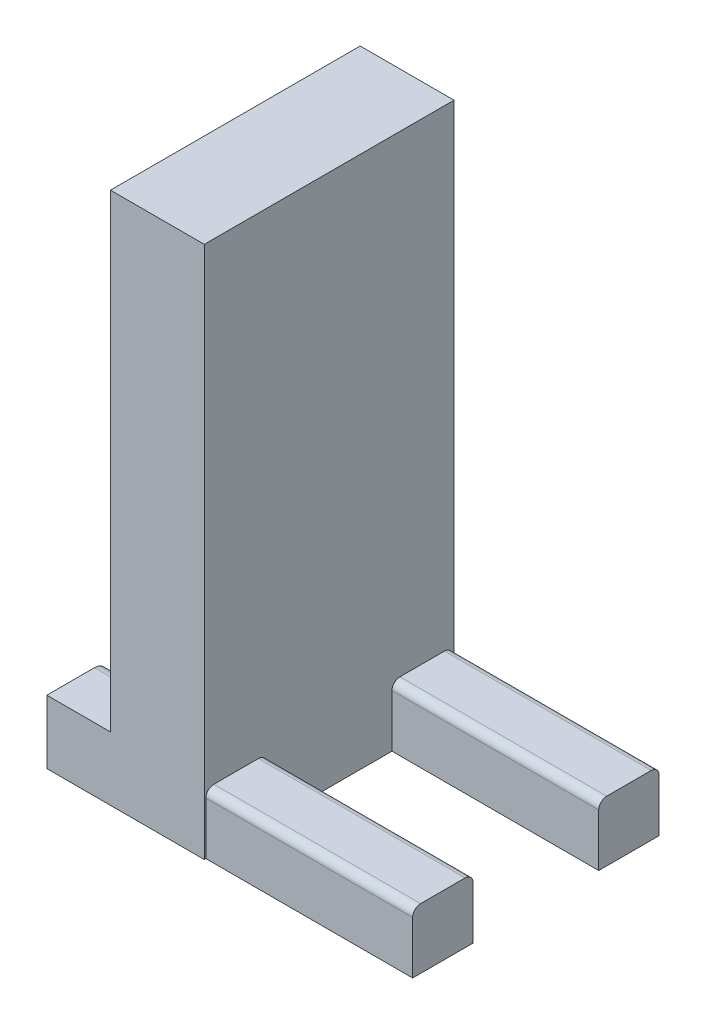
from build123d import *

# Parameters (mm, degrees)
SKETCH_2_W          = 5.9
SKETCH_2_H          = 15.7
EXTRUDE_1_DEPTH     = 33.5
SKETCH_3_R          = 0.975
CUT_EXTRUDE_1_DEPTH = 10
SKETCH_4_W          = 3.8
SKETCH_4_H          = 3.8
EXTRUDE_2_DEPTH     = 13
SKETCH_5_W          = 3.8
SKETCH_5_H          = 4
EXTRUDE_3_DEPTH     = 4
FILLET_1_R          = 0.8
FILLET_2_R          = 0.5


with BuildPart() as part:
    # ｽｹｯﾁ2 → ﾎﾞｽ - 押し出し1 (new body)
    with BuildSketch(Plane(origin=(0, 0, 0), x_dir=(1, 0, 0), z_dir=(0, 1, 0))):
        Rectangle(SKETCH_2_W, SKETCH_2_H)
    extrude(amount=EXTRUDE_1_DEPTH)

    # ｽｹｯﾁ3 → ｶｯﾄ - 押し出し1 (cut)
    with BuildSketch(Plane.XZ):
        with Locations(Location((0, 0, 0), (0, 0, 270))):
            Circle(SKETCH_3_R)
    extrude(amount=-CUT_EXTRUDE_1_DEPTH, mode=Mode.SUBTRACT)

    # ｽｹｯﾁ4 → ﾎﾞｽ - 押し出し2 (add)
    with BuildSketch(Plane(origin=(2.95, 0, 0), x_dir=(0, 0, -1), z_dir=(1, 0, 0))):
        with Locations((-5.85, 1.9)):
            Rectangle(SKETCH_4_W, SKETCH_4_H)
        with Locations((5.85, 1.9)):
            Rectangle(SKETCH_4_W, SKETCH_4_H)
    extrude(amount=EXTRUDE_2_DEPTH)

    # ｽｹｯﾁ5 → ﾎﾞｽ - 押し出し3 (add)
    with BuildSketch(Plane.ZY.offset(2.95)):
        with Locations((-5.95, 2)):
            Rectangle(SKETCH_5_W, SKETCH_5_H)
        with Locations((5.95, 2)):
            Rectangle(SKETCH_5_W, SKETCH_5_H)
    extrude(amount=EXTRUDE_3_DEPTH)

    # ﾌｨﾚｯﾄ1
    fillet_1_edges = [part.edges().sort_by_distance(p)[0] for p in [
        (-4.95, 4, -4.05),
        (-4.95, 4, 4.05),
    ]]
    fillet(fillet_1_edges, radius=FILLET_1_R)

    # ﾌｨﾚｯﾄ2
    fillet_2_edges = [part.edges().sort_by_distance(p)[0] for p in [
        (9.45, 3.8, 7.75),
        (9.45, 3.8, 3.95),
        (9.45, 3.8, -3.95),
        (9.45, 3.8, -7.75),
    ]]
    fillet(fillet_2_edges, radius=FILLET_2_R)


solid = part.part
